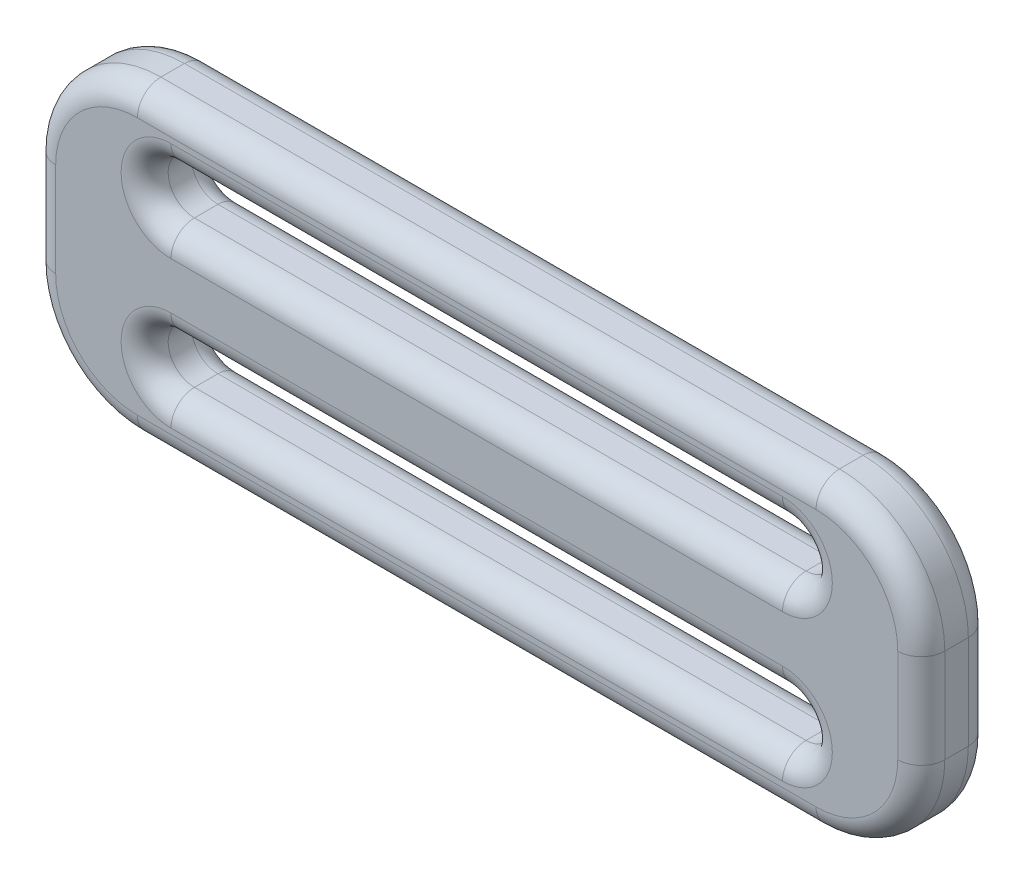
from build123d import *

# Parameters (mm, degrees)
BOSS_EXTRUDE1_DEPTH = 3
FILLET1_R           = 1


with BuildPart() as part:
    # Sketch1 → Boss-Extrude1 (new body)
    with BuildSketch(Plane(origin=(0, 0, 0.6), x_dir=(-1, 0, 0), z_dir=(0, 0, -1))):
        with BuildLine():
            Line((-4.473372781, 35.786982249), (-33.326627219, 35.786982249))
            ThreePointArc((-33.326627219, 35.786982249), (-36.489779447, 34.476761696), (-37.8, 31.313609467))
            Line((-37.8, 31.313609467), (-37.8, 27.313609467))
            ThreePointArc((-37.8, 27.313609467), (-36.489779447, 24.150457239), (-33.326627219, 22.840236686))
            Line((-33.326627219, 22.840236686), (-4.473372781, 22.840236686))
            ThreePointArc((-4.473372781, 22.840236686), (-1.310220553, 24.150457239), (0, 27.313609467))
            Line((0, 27.313609467), (0, 31.313609467))
            ThreePointArc((0, 31.313609467), (-1.310220553, 34.476761696), (-4.473372781, 35.786982249))
        make_face()
        with BuildLine():
            Line((-5.9, 27.313609467), (-31.9, 27.313609467))
            ThreePointArc((-31.9, 27.313609467), (-33.018343195, 26.195266272), (-31.9, 25.076923077))
            Line((-31.9, 25.076923077), (-5.9, 25.076923077))
            ThreePointArc((-5.9, 25.076923077), (-4.781656805, 26.195266272), (-5.9, 27.313609467))
        make_face(mode=Mode.SUBTRACT)
        with BuildLine():
            Line((-5.9, 31.31385603), (-31.9, 31.31385603))
            ThreePointArc((-31.9, 31.31385603), (-33.018343195, 32.432199225), (-31.9, 33.550542421))
            Line((-31.9, 33.550542421), (-5.9, 33.550542421))
            ThreePointArc((-5.9, 33.550542421), (-4.781656805, 32.432199225), (-5.9, 31.31385603))
        make_face(mode=Mode.SUBTRACT)
    extrude(amount=-BOSS_EXTRUDE1_DEPTH)

    # Fillet1
    fillet1_edges = [part.edges().sort_by_distance(p)[0] for p in [
        (36.489779447, 34.476761696, 3.6),
        (18.9, 35.786982249, 0.6),
        (1.310220553, 34.476761696, 0.6),
        (37.8, 29.313609467, 3.6),
        (36.489779447, 24.150457239, 3.6),
        (18.9, 22.840236686, 3.6),
        (1.310220553, 24.150457239, 3.6),
        (4.781656805, 26.195266272, 3.6),
        (18.9, 25.076923077, 3.6),
        (33.018343195, 26.195266272, 3.6),
        (18.9, 27.313609467, 3.6),
        (0, 29.313609467, 3.6),
        (4.781656805, 26.195266272, 0.6),
        (18.9, 27.313609467, 0.6),
        (33.018343195, 26.195266272, 0.6),
        (18.9, 25.076923077, 0.6),
        (4.781656805, 32.432199225, 3.6),
        (18.9, 31.31385603, 3.6),
        (33.018343195, 32.432199225, 3.6),
        (18.9, 33.550542421, 3.6),
        (4.781656805, 32.432199225, 0.6),
        (18.9, 33.550542421, 0.6),
        (33.018343195, 32.432199225, 0.6),
        (18.9, 31.31385603, 0.6),
        (1.310220553, 34.476761696, 3.6),
        (18.9, 35.786982249, 3.6),
        (0, 29.313609467, 0.6),
        (1.310220553, 24.150457239, 0.6),
        (18.9, 22.840236686, 0.6),
        (36.489779447, 24.150457239, 0.6),
        (37.8, 29.313609467, 0.6),
        (36.489779447, 34.476761696, 0.6),
    ]]
    fillet(fillet1_edges, radius=FILLET1_R)


solid = part.part
